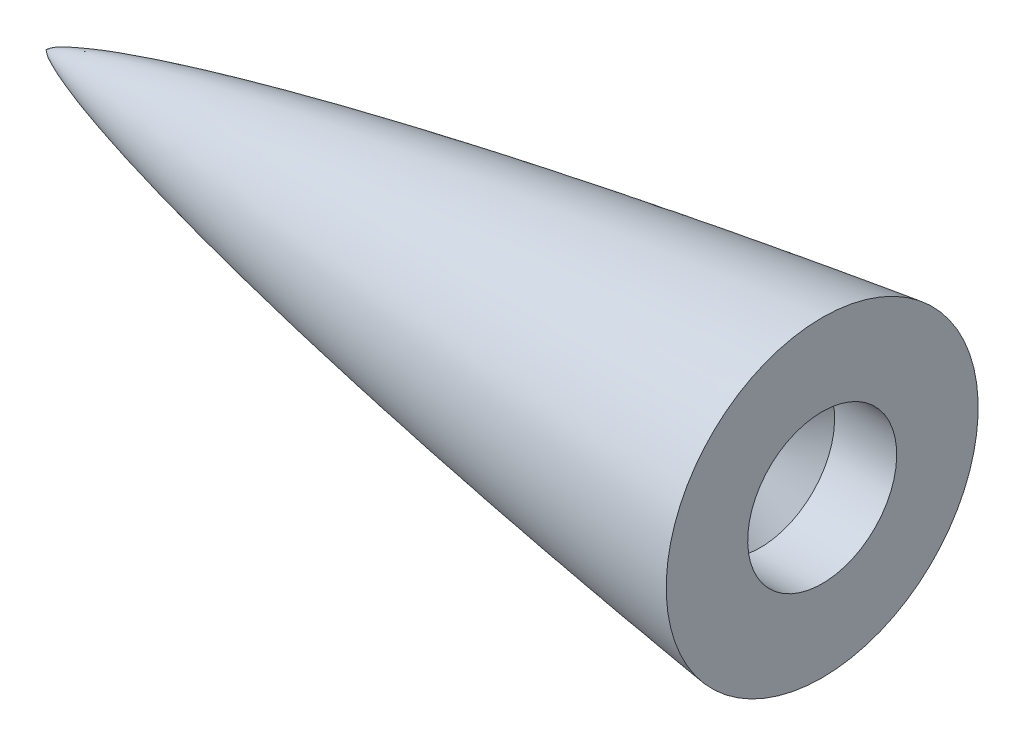
from build123d import *


with BuildPart() as part:
    # Sketch1 → Revolve1 (revolve)
    with BuildSketch(Plane.XY):
        with BuildLine():
            Line((125, 12), (125, 25.12))
            add(Edge.make_bspline(
                [(0, 0), (0.323780021, 0.255775241), (0.94016744, 0.742700408), (1.995866478, 1.205004503), (2.989144376, 1.658557495), (3.997714551, 2.039831811), (4.996382984, 2.413229118), (5.998639016, 2.760710114), (6.998726717, 3.100380082), (7.996474593, 3.434406564), (9.000818165, 3.737346339), (9.996482368, 4.055038983), (11.000411882, 4.338637006), (12.000026496, 4.629892194), (12.998605154, 4.921538085), (13.998553447, 5.201956918), (15.000333418, 5.468756131), (15.998435353, 5.742565197), (17.000148219, 5.999450091), (18.000144663, 6.259422331), (18.998476692, 6.522650592), (20.000361352, 6.768553191), (20.99850931, 7.022744558), (22.000208976, 7.259145775), (22.999882776, 7.500490147), (24.00025992, 7.738893639), (24.998336927, 7.983753601), (26.001938406, 8.205045523), (26.996910252, 8.456762946), (28.001684387, 8.665890311), (28.999889775, 8.900479073), (29.998756042, 9.132195447), (31.000088642, 9.349617017), (32.000174341, 9.569181223), (32.998530369, 9.793504485), (34.001594358, 9.995916733), (34.998517111, 10.223565036), (36.000227035, 10.428940627), (36.999888355, 10.640531727), (38.000219545, 10.848932463), (38.998578998, 11.063597697), (40.001530122, 11.255869137), (40.998579314, 11.473597898), (42.000217847, 11.668933756), (42.999892247, 11.870538941), (44.000213164, 12.06891048), (44.998630108, 12.27369095), (46.00150949, 12.455592416), (46.998462544, 12.664551243), (48.001509459, 12.845592105), (48.99863076, 13.053689499), (50.000210318, 13.238917979), (50.999900609, 13.430522563), (52.000187247, 13.618991768), (52.998755188, 13.813394489), (54.001214911, 13.986766369), (54.999962631, 14.180201923), (55.998934432, 14.372426659), (57.000125577, 14.549321163), (57.999966126, 14.730183185), (59.00000992, 14.909946098), (59.999994195, 15.090032425), (61.000013299, 15.269924203), (61.999952608, 15.450270765), (63.000176269, 15.628992738), (63.998777281, 15.813653798), (65.001318823, 15.975797021), (65.998777361, 16.163653345), (67.000175679, 16.328996099), (67.999952984, 16.500268649), (69.000012385, 16.669929305), (69.999997475, 16.840014133), (70.999997715, 17.010014165), (72.000011667, 17.179929207), (72.999955619, 17.350269007), (74.000165859, 17.518994764), (74.998846385, 17.693658445), (76.00123627, 17.845840603), (76.998885639, 18.02342053), (78.000008888, 18.179946135), (79.001078778, 18.336795105), (79.998888397, 18.513403896), (81.000154867, 18.669061096), (81.999955903, 18.830268357), (83.000021521, 18.989865476), (83.999958012, 19.150269737), (85.000146431, 19.309055574), (85.998952462, 19.473425056), (87.001016789, 19.616773267), (88.00000764, 19.779950705), (88.998952676, 19.943423765), (90.001154308, 20.085886002), (90.998952758, 20.253423233), (92.000007612, 20.399950892), (93.001016769, 20.546773348), (93.998952451, 20.713425295), (95.000145959, 20.859057996), (95.999958452, 21.010269228), (97.000020234, 21.159865094), (97.999960613, 21.310270397), (99.000137314, 21.459053318), (99.999017405, 21.613443264), (101.000953088, 21.746760174), (102.000010515, 21.899927471), (102.99900488, 22.053529735), (104.001129573, 22.18554298), (104.998843482, 22.344642847), (106.001129651, 22.475542446), (106.999004952, 22.633529238), (108.000010502, 22.769927566), (109.000953009, 22.906760703), (109.999017622, 23.063441832), (111.000136053, 23.199061769), (111.999964155, 23.34024688), (113.000007328, 23.479950712), (114.000006532, 23.619950272), (114.999966542, 23.760248198), (116.000127298, 23.899056934), (116.999082891, 24.043460261), (118.000889734, 24.166742543), (119.000009833, 24.309927161), (119.999070959, 24.453548621), (121.001054567, 24.575521533), (121.998920281, 24.724664781), (123.001054633, 24.845521042), (123.999071027, 24.993548118), (124.666511026, 25.077819588), (125, 25.12)],
                knots=[0, 0, 0, 0, 0.004059284, 0.007727751, 0.011326783, 0.014862694, 0.018375203, 0.021865397, 0.025344846, 0.028813832, 0.032262738, 0.035711644, 0.03914162, 0.042571595, 0.04600157, 0.049422516, 0.052834727, 0.056246939, 0.059650712, 0.063054485, 0.066458258, 0.069853891, 0.073249524, 0.076637318, 0.080025112, 0.083412907, 0.086800701, 0.090180959, 0.093568753, 0.09694178, 0.100322038, 0.103702296, 0.107075323, 0.11044835, 0.113821377, 0.11718748, 0.120560507, 0.123926609, 0.127292712, 0.130658814, 0.134024917, 0.137384404, 0.140750507, 0.144109994, 0.147469481, 0.150828968, 0.154188455, 0.157541637, 0.160901124, 0.164254306, 0.167613793, 0.170966975, 0.174320157, 0.17767334, 0.181026522, 0.184373711, 0.187726893, 0.191080075, 0.194427265, 0.197774454, 0.201121644, 0.204468833, 0.207816023, 0.211163212, 0.214510402, 0.217857591, 0.221199102, 0.224546292, 0.227887803, 0.231229313, 0.234570824, 0.237912335, 0.241253846, 0.244595357, 0.247936868, 0.251278379, 0.25461989, 0.257956038, 0.261297549, 0.264633697, 0.267969845, 0.271311356, 0.274647504, 0.277983652, 0.2813198, 0.284655948, 0.287992096, 0.291328244, 0.294659346, 0.297995494, 0.301331642, 0.304662744, 0.307998892, 0.311329994, 0.314661097, 0.317997245, 0.321328347, 0.324659449, 0.327990551, 0.331321653, 0.334652756, 0.337983858, 0.341310233, 0.344641335, 0.347972437, 0.351298812, 0.354629915, 0.35795629, 0.361287392, 0.364613767, 0.367940142, 0.371271244, 0.374597619, 0.377923994, 0.381250369, 0.384576744, 0.38790312, 0.391229495, 0.39455587, 0.397877837, 0.401204213, 0.404530588, 0.407852555, 0.41117893, 0.414500898, 0.417827273, 0.421149241, 0.421149241, 0.421149241, 0.421149241], degree=3))
            Line((0, 0), (21.825, 0))
            Line((21.825, 0), (25, 3.175))
            Line((25, 3.175), (106.175, 3.175))
            Line((106.175, 3.175), (115, 12))
            Line((115, 12), (125, 12))
        make_face()
    revolve(axis=Axis((1366, 0, 0), (-1, 0, 0)))


solid = part.part
